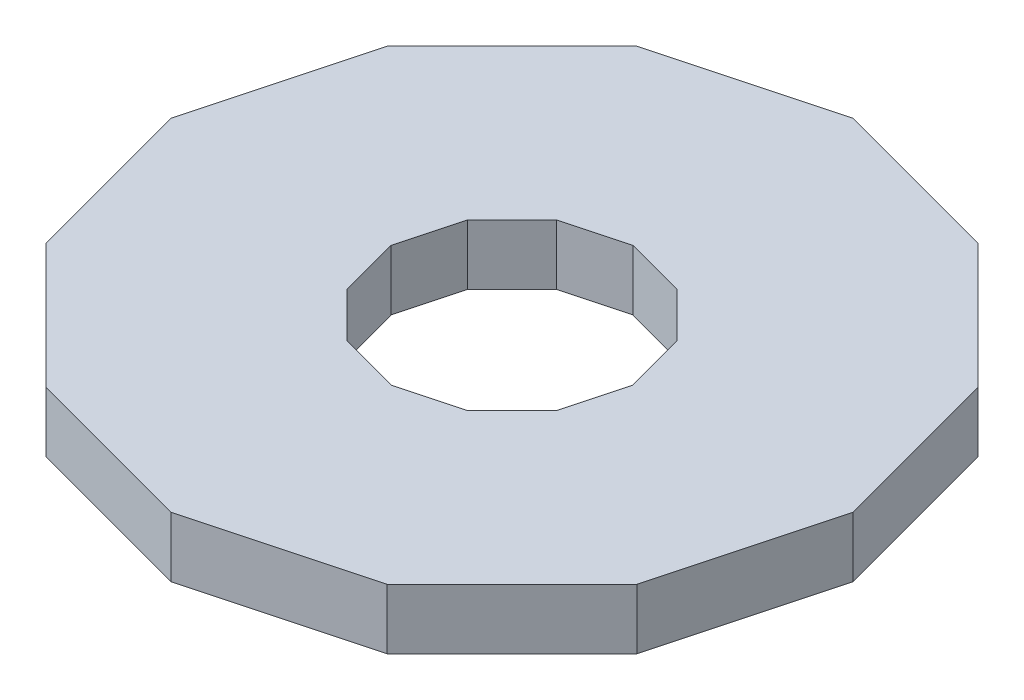
from build123d import *

# Parameters (mm, degrees)
BOSS_EXTRUDE2_DEPTH = 19.05


with BuildPart() as part:
    # Sketch2 → Boss-Extrude2 (new body)
    with BuildSketch(Plane(origin=(0, 0, 0), x_dir=(1, 0, 0), z_dir=(0, 1, 0))):
        Polygon((-107.951870346, 0), (-93.489062106, -53.975935173), (-53.975935173, -93.489062106), (0, -107.951870346), (53.975935173, -93.489062106), (93.489062106, -53.975935173), (107.951870346, 0), (93.489062106, 53.975935173), (53.975935173, 93.489062106), (0, 107.951870346), (-53.975935173, 93.489062106), (-93.489062106, 53.975935173), align=None)
        Polygon((-38.267430643, 0), (-33.140567074, -19.133715321), (-19.133715321, -33.140567074), (0, -38.267430643), (19.133715321, -33.140567074), (33.140567074, -19.133715321), (38.267430643, 0), (33.140567074, 19.133715321), (19.133715321, 33.140567074), (0, 38.267430643), (-19.133715321, 33.140567074), (-33.140567074, 19.133715321), align=None, mode=Mode.SUBTRACT)
    extrude(amount=BOSS_EXTRUDE2_DEPTH)


solid = part.part
